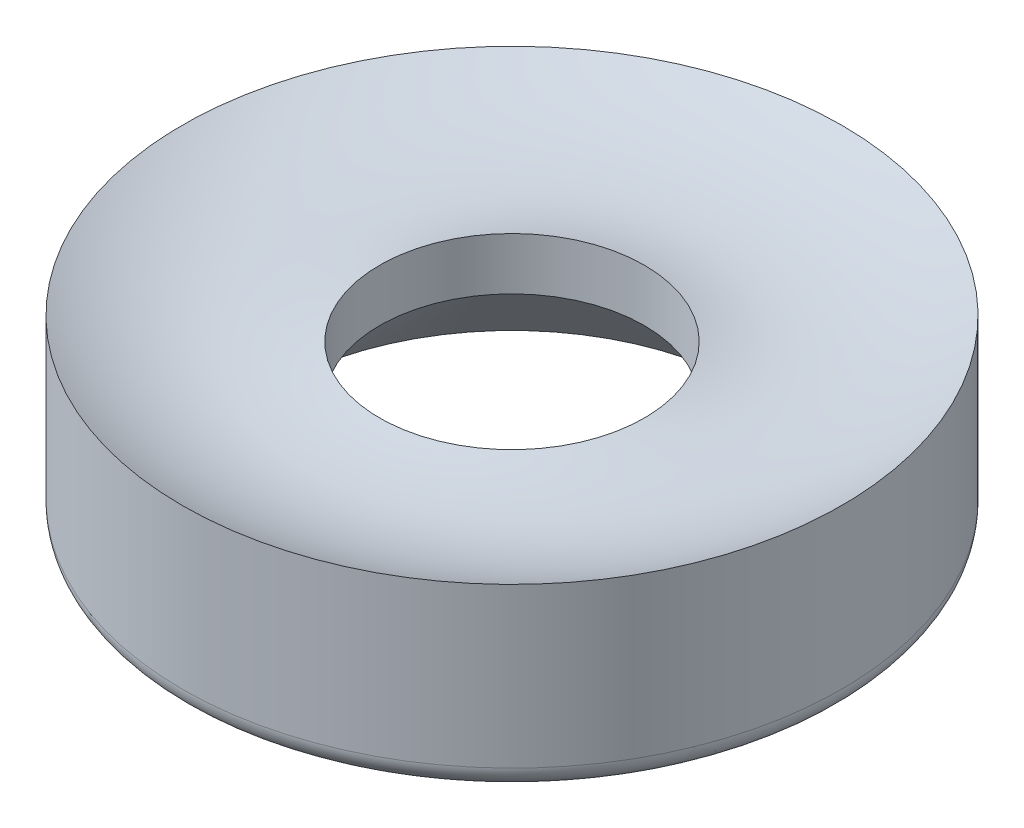
from build123d import *

# Parameters (mm, degrees)
SKETCH1_R           = 36.83
BOSS_EXTRUDE1_DEPTH = 20.32
FILLET1_R           = 2.54
SKETCH2_R           = 26.67
SKETCH3_R           = 14.7955
SKETCH4_R           = 14.7955
CUT_EXTRUDE1_DEPTH  = 76.2
SKETCH18_R          = 3.175
CUT_EXTRUDE2_DEPTH  = 6.35
CUT_EXTRUDE3_DEPTH  = 6.35
CUT_EXTRUDE4_START  = 2.54
CUT_EXTRUDE4_DEPTH  = 2.54
CIRPATTERN1_COUNT   = 4


with BuildPart() as part:
    # Sketch1 → Boss-Extrude1 (new body)
    with BuildSketch(Plane(origin=(0, 0, 0), x_dir=(1, 0, 0), z_dir=(0, 1, 0))):
        with Locations(Location((0, 0, 0), (0, 0, 270))):
            Circle(SKETCH1_R)
    extrude(amount=BOSS_EXTRUDE1_DEPTH)

    # Fillet1
    fillet1_edges = [part.edges().sort_by_distance(p)[0] for p in [
        (0, 0, -36.83),
    ]]
    fillet(fillet1_edges, radius=FILLET1_R)

    # Sketch2 → Cut-Loft1 section 0
    with BuildSketch(Plane(origin=(0, 0, 0), x_dir=(1, 0, 0), z_dir=(0, 1, 0))):
        Circle(SKETCH2_R)
    # Sketch3 → Cut-Loft1 section 1
    with BuildSketch(Plane(origin=(0, 11.938, 0), x_dir=(1, 0, 0), z_dir=(0, 1, 0))):
        Circle(SKETCH3_R)
    loft(mode=Mode.SUBTRACT)

    # Sketch4 → Cut-Extrude1 (cut)
    with BuildSketch(Plane.XZ.offset(-11.938)):
        with Locations(Location((0, 0, 0), (0, 0, 270))):
            Circle(SKETCH4_R)
    extrude(amount=-CUT_EXTRUDE1_DEPTH, mode=Mode.SUBTRACT)

    # Sketch17 → Cut-Revolve1 (revolve, cut)
    with BuildSketch(Plane(origin=(0, 0, 0), x_dir=(0, 0, -1), z_dir=(1, 0, 0))):
        with BuildLine():
            Line((36.83, 20.32), (14.7955, 20.32))
            Line((14.7955, 20.32), (14.7955, 17.78))
            ThreePointArc((14.7955, 17.78), (26.041766832, 17.063278986), (36.83, 20.32))
        make_face()
    revolve(axis=Axis((0, 0, 0), (0, 1, 0)), mode=Mode.SUBTRACT)

    # Sketch18 → Cut-Extrude2 (cut)
    with BuildSketch(Plane.XZ):
        with Locations(Location((0, 30.431156816, 0), (0, 0, 270))):
            Circle(SKETCH18_R)
        with Locations(Location((-30.431156816, 0, 0), (0, 0, 270))):
            Circle(SKETCH18_R)
        with Locations(Location((0, -30.431156816, 0), (0, 0, 270))):
            Circle(SKETCH18_R)
        with Locations(Location((30.431156816, 0, 0), (0, 0, 270))):
            Circle(SKETCH18_R)
    extrude(amount=-CUT_EXTRUDE2_DEPTH, mode=Mode.SUBTRACT)

    # Sketch19 → Cut-Extrude3 (cut)
    with BuildSketch(Plane.XZ):
        with BuildLine():
            Line((4.259709497, -31.701156816), (2.909935566, -31.701156816))
            ThreePointArc((2.909935566, -31.701156816), (3.175, -30.431156816), (2.909935566, -29.161156816))
            Line((2.909935566, -29.161156816), (4.259709497, -29.161156816))
            ThreePointArc((4.259709497, -29.161156816), (4.445, -30.431156816), (4.259709497, -31.701156816))
        make_face()
    cut_extrude3 = extrude(amount=-CUT_EXTRUDE3_DEPTH, mode=Mode.SUBTRACT)

    # Sketch20 → Cut-Extrude4 (cut)
    with BuildSketch(Plane.XZ.offset(-6.35).offset(CUT_EXTRUDE4_START)):
        with BuildLine():
            Line((-1.27, -34.690866313), (-1.27, -33.341092382))
            ThreePointArc((-1.27, -33.341092382), (1.15960956, -33.3868176), (2.909935566, -31.701156816))
            Line((2.909935566, -31.701156816), (4.259709497, -31.701156816))
            ThreePointArc((4.259709497, -31.701156816), (2.114043859, -34.341251899), (-1.27, -34.690866313))
        make_face()
    cut_extrude4 = extrude(amount=-CUT_EXTRUDE4_DEPTH, mode=Mode.SUBTRACT)

    # CirPattern1: Cut-Extrude3, Cut-Extrude4 ×4 about axis
    cirpattern1_axis = Axis((0, 0, 0), (0, 1, 0))
    add([cut_extrude3.rotate(cirpattern1_axis, i * 360 / CIRPATTERN1_COUNT) for i in range(1, CIRPATTERN1_COUNT)], mode=Mode.SUBTRACT)
    add([cut_extrude4.rotate(cirpattern1_axis, i * 360 / CIRPATTERN1_COUNT) for i in range(1, CIRPATTERN1_COUNT)], mode=Mode.SUBTRACT)


solid = part.part
